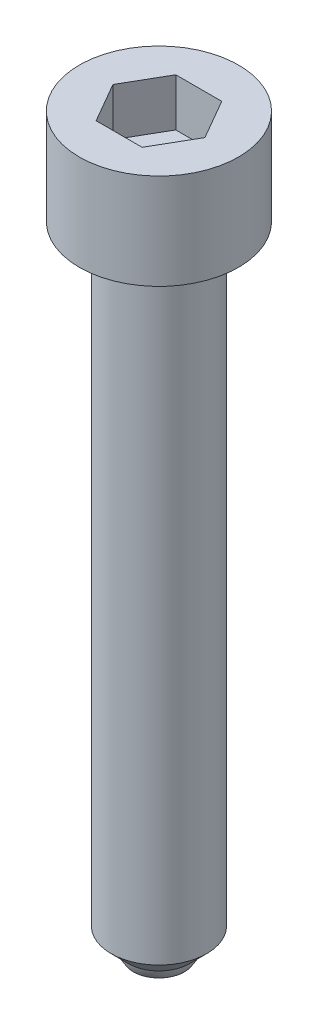
from build123d import *

# Parameters (mm, degrees)
CUT_EXTRUDE1_DEPTH = 3


with BuildPart() as part:
    # Sketch1 → Revolve1 (revolve)
    with BuildSketch(Plane.XY, mode=Mode.PRIVATE) as revolve1_sk:
        with BuildLine():
            Line((0, -40), (1.6, -40))
            ThreePointArc((1.6, -40), (1.77941078, -39.713070248), (1.907878403, -39.4))
            Line((1.907878403, -39.4), (3, -38.307878403))
            Line((3, -38.307878403), (3, 0))
            Line((3, 0), (5, 0))
            Line((5, 0), (5, 6))
            Line((5, 6), (0, 6))
            Line((0, 6), (0, -40))
        make_face()
    revolve(revolve1_sk.sketch.rotate(Axis((0, 61.691642626, 0), (0, -1, 0)), 90), axis=Axis((0, 61.691642626, 0), (0, -1, 0)))

    # Sketch2 → Cut-Extrude1 (cut)
    with BuildSketch(Plane(origin=(0, 6, 0), x_dir=(-1, 0, 0), z_dir=(0, 1, 0))):
        Polygon((-1.443375673, -2.5), (1.443375673, -2.5), (2.886751346, 0), (1.443375673, 2.5), (-1.443375673, 2.5), (-2.886751346, 0), align=None)
    extrude(amount=-CUT_EXTRUDE1_DEPTH, mode=Mode.SUBTRACT)


solid = part.part
